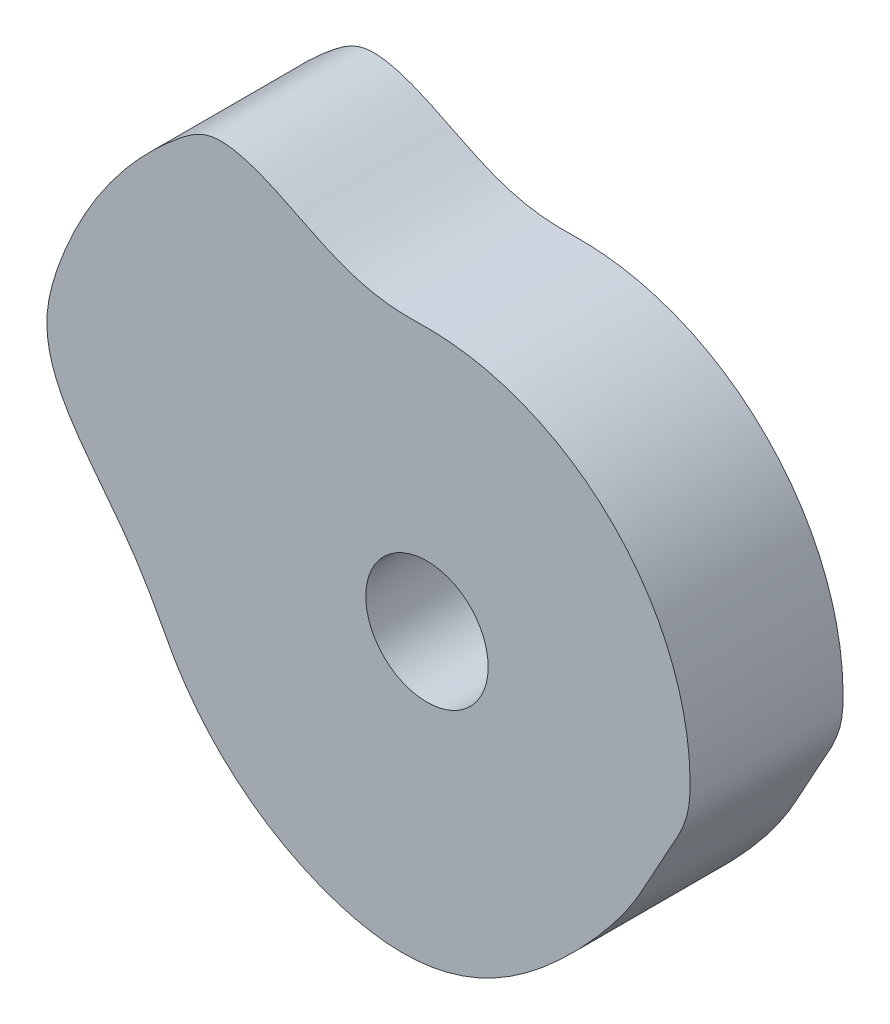
from build123d import *

# Parameters (mm, degrees)
EXTRUDE_1_DEPTH     = 25
SKETCH_2_R          = 10
CUT_EXTRUDE_1_DEPTH = 25


with BuildPart() as part:
    # 草图1 → 凸台-拉伸1 (new body)
    with BuildSketch(Plane.XY):
        with BuildLine():
            add(Edge.make_bspline(
                [(-0.0087, 43), (-0.136801246, 42.999974952), (-0.407441059, 42.998766051), (-0.832136373, 42.99455358), (-1.294130239, 42.989512439), (-1.7901566, 42.984526724), (-2.319432897, 42.982257504), (-2.880930732, 42.984414446), (-3.473264397, 42.993353644), (-4.094707637, 43.011728838), (-4.74309332, 43.042050093), (-5.415836583, 43.086499882), (-6.109912176, 43.147543537), (-6.822049055, 43.226769244), (-7.548570838, 43.326161618), (-8.28582959, 43.446231966), (-9.030064569, 43.587780855), (-9.777675941, 43.750781386), (-10.525462945, 43.934475465), (-11.270486369, 44.138011479), (-12.01037436, 44.360113901), (-12.743207067, 44.599213347), (-13.46755524, 44.853759027), (-14.182631286, 45.121610152), (-14.887824829, 45.401437576), (-15.583162743, 45.69109368), (-16.268800862, 45.989010998), (-16.94511139, 46.293617539), (-17.612622808, 46.60343428), (-18.271898468, 46.916975053), (-18.923664827, 47.232625632), (-19.568330886, 47.549457156), (-20.2065692, 47.865924838), (-20.838840452, 48.180718731), (-21.465282629, 48.492938602), (-22.086405093, 48.800769315), (-22.702083929, 49.103500141), (-23.312324139, 49.399797612), (-23.917108048, 49.688183152), (-24.515839683, 49.968055714), (-25.108437608, 50.237595421), (-25.694057407, 50.496318404), (-26.272226986, 50.742716915), (-26.842057273, 50.976120623), (-27.402841198, 51.195357032), (-27.953591701, 51.399839699), (-28.493345529, 51.588807405), (-29.021099894, 51.761769203), (-29.535911186, 51.918086626), (-30.036801652, 52.057491891), (-30.522749568, 52.180089658), (-30.992938579, 52.285742712), (-31.446589144, 52.374802285), (-31.883198953, 52.447259403), (-32.302264075, 52.503976933), (-32.703607745, 52.545496988), (-33.087293474, 52.572513943), (-33.453682872, 52.585769754), (-33.803402817, 52.586244349), (-34.137382489, 52.574624574), (-34.45690126, 52.551844259), (-34.763531167, 52.518204266), (-35.059054933, 52.474439263), (-35.34554334, 52.420877049), (-35.625065777, 52.357102176), (-35.900022529, 52.283360548), (-36.172712283, 52.199021259), (-36.445350376, 52.10334573), (-36.720146201, 51.995474056), (-36.999152779, 51.874447439), (-37.284087058, 51.738810946), (-37.576740593, 51.587714415), (-37.878406034, 51.419857325), (-38.190230811, 51.234035113), (-38.513264952, 51.029392301), (-38.848273378, 50.80494079), (-39.196038006, 50.560145128), (-39.557098495, 50.294485672), (-39.932008194, 50.007720932), (-40.321399641, 49.699943452), (-40.725634914, 49.371171378), (-41.14220467, 49.024745914), (-41.565260904, 48.666599849), (-41.988308339, 48.30201179), (-42.408253609, 47.933798413), (-42.824965586, 47.561916245), (-43.238321887, 47.186302779), (-43.648428976, 46.807180785), (-44.05531959, 46.424613528), (-44.458620092, 46.038244131), (-44.858789404, 45.648620452), (-45.255347515, 45.255347515), (-45.648620453, 44.858789404), (-46.038244129, 44.45862009), (-46.424613538, 44.055319599), (-46.807180748, 43.648428945), (-47.186302918, 43.238322004), (-47.561915728, 42.824965149), (-47.933800342, 42.40825524), (-48.302004592, 41.988302254), (-48.666643323, 41.565264343), (-49.027394649, 41.138872519), (-49.384642891, 40.709568456), (-49.737932173, 40.276976865), (-50.087524796, 39.841404878), (-50.433351966, 39.402824857), (-50.775207765, 38.961171938), (-51.113388895, 38.516723924), (-51.447432113, 38.069138182), (-51.777777762, 37.618794795), (-52.104055471, 37.165484811), (-52.426351944, 36.709333685), (-52.744801495, 36.250487924), (-53.059018205, 35.788749725), (-53.369430176, 35.324454558), (-53.675538922, 34.857314222), (-53.97783332, 34.387659146), (-54.275744439, 33.915223228), (-54.569731706, 33.440339509), (-54.859337521, 32.962804404), (-55.145066351, 32.48292908), (-55.42626102, 32.00037046), (-55.703527831, 31.515523034), (-55.976387413, 31.02820883), (-56.245044448, 30.538582233), (-56.509296559, 30.046548047), (-56.769430659, 29.55231061), (-57.025104614, 29.055756028), (-57.276547902, 28.557070866), (-57.523524319, 28.056119025), (-57.766230888, 27.553097527), (-58.004438952, 27.047928301), (-58.238249859, 26.540710119), (-58.467638467, 26.031463054), (-58.692516942, 25.520216236), (-58.91308064, 25.007101563), (-59.129026488, 24.49202226), (-59.340564316, 23.975128422), (-59.547476062, 23.456362805), (-59.749812029, 22.935815943), (-59.947799554, 22.413572259), (-60.140463282, 21.891123917), (-60.327099032, 21.371640471), (-60.505807364, 20.857970478), (-60.676219819, 20.35169593), (-60.837449134, 19.852530966), (-60.989805395, 19.360499291), (-61.132854899, 18.875385964), (-61.266200832, 18.396966006), (-61.390184092, 17.925244629), (-61.504262213, 17.459853677), (-61.608698411, 17.000726879), (-61.70322647, 16.547506834), (-61.787833588, 16.099975505), (-61.862513962, 15.657795072), (-61.927417656, 15.220718715), (-61.982523212, 14.788368514), (-62.027800238, 14.360375474), (-62.063290476, 13.936310631), (-62.088922872, 13.515769157), (-62.104882194, 13.098328182), (-62.111108706, 12.683516077), (-62.10765592, 12.270866494), (-62.094353079, 11.859881462), (-62.071229461, 11.450131809), (-62.038344613, 11.041105155), (-61.995398903, 10.632421262), (-61.942427585, 10.223573183), (-61.879424287, 9.81420857), (-61.806029258, 9.403930359), (-61.722246692, 8.992420571), (-61.6279935, 8.579330737), (-61.52298567, 8.164429807), (-61.407176267, 7.747468352), (-61.280542809, 7.328241536), (-61.142669239, 6.906729143), (-60.993899874, 6.482688724), (-60.833944831, 6.056119791), (-60.66256931, 5.627079189), (-60.480237456, 5.19541266), (-60.286612037, 4.761285825), (-60.081932736, 4.324680526), (-59.866285042, 3.885698088), (-59.639672911, 3.4445058), (-59.402404472, 3.001133348), (-59.154637682, 2.55566729), (-58.896615437, 2.108288231), (-58.62858506, 1.659076818), (-58.350996693, 1.208094331), (-58.063998486, 0.75548998), (-57.768238332, 0.301226424), (-57.463584199, -0.154345594), (-57.151019869, -0.611546605), (-56.830678235, -1.070156264), (-56.503012179, -1.530149798), (-56.168603979, -1.991668893), (-55.827748396, -2.454656326), (-55.481077055, -2.919208892), (-55.128949746, -3.38535534), (-54.772101056, -3.853341157), (-54.410725175, -4.323100456), (-54.045635528, -4.79494129), (-53.677071874, -5.268778392), (-53.305837746, -5.745014758), (-52.932375945, -6.223714528), (-52.556938036, -6.704858868), (-52.180667195, -7.188989927), (-51.803420134, -7.675731061), (-51.426378768, -8.165677949), (-51.049653639, -8.658586755), (-50.674096208, -9.154726539), (-50.299966874, -9.653816146), (-49.928208484, -10.156130034), (-49.559171848, -10.661403811), (-49.193236283, -11.169373662), (-48.831482889, -11.680219568), (-48.473815319, -12.193146555), (-48.121149125, -12.708162345), (-47.773932439, -13.224756119), (-47.432277775, -13.742269968), (-47.096842089, -14.260288663), (-46.768150719, -14.778327896), (-46.446054103, -15.295421886), (-46.130943373, -15.810960998), (-45.823101724, -16.324312285), (-45.522465415, -16.834608651), (-45.229067865, -17.341052296), (-44.943073001, -17.842921264), (-44.664047074, -18.339292633), (-44.392154348, -18.829553029), (-44.126936062, -19.312840294), (-43.868453253, -19.788567673), (-43.616000527, -20.255864249), (-43.369760345, -20.714327505), (-43.128743619, -21.163036355), (-42.893406799, -21.601852119), (-42.662643928, -22.029857955), (-42.43670304, -22.446903744), (-42.214925181, -22.852397599), (-41.996974307, -23.246002634), (-41.782835528, -23.627598704), (-41.570777552, -23.99845838), (-41.358722403, -24.36213605), (-41.144521292, -24.722100882), (-40.927218358, -25.080217479), (-40.706805761, -25.436428237), (-40.483323885, -25.790725194), (-40.25671791, -26.14304088), (-40.026996354, -26.493323765), (-39.794321782, -26.841626321), (-39.558581476, -27.187874322), (-39.319837411, -27.532043633), (-39.077946071, -27.874041082), (-38.833321357, -28.214071725), (-38.585589034, -28.551844013), (-38.334988479, -28.887463067), (-38.081450031, -29.220912546), (-37.825020552, -29.552135861), (-37.5656583, -29.881100311), (-37.303464685, -30.207765097), (-37.038504466, -30.532212942), (-36.770538961, -30.854157045), (-36.499981963, -31.173908502), (-36.226526987, -31.491215909), (-35.950375339, -31.806183048), (-35.67147504, -32.118735206), (-35.389720854, -32.428680015), (-35.105455066, -32.736329985), (-34.818431001, -33.041429822), (-34.528760187, -33.344014895), (-34.236412318, -33.644023573), (-33.941541048, -33.941541048), (-33.644023573, -34.236412318), (-33.344014895, -34.528760187), (-33.041429822, -34.818431001), (-32.736329985, -35.105455066), (-32.428680015, -35.389720854), (-32.118735206, -35.67147504), (-31.806183048, -35.950375339), (-31.491215909, -36.226526987), (-31.173908502, -36.499981963), (-30.854157045, -36.770538961), (-30.532212942, -37.038504466), (-30.207765097, -37.303464685), (-29.881100311, -37.5656583), (-29.552135861, -37.825020552), (-29.220912546, -38.081450031), (-28.887463067, -38.334988479), (-28.551844013, -38.585589034), (-28.214071725, -38.833321357), (-27.874041082, -39.077946071), (-27.532043633, -39.319837411), (-27.187874322, -39.558581476), (-26.841626321, -39.794321782), (-26.493323764, -40.026996353), (-26.143040882, -40.256717913), (-25.790725187, -40.483323872), (-25.436428266, -40.706805809), (-25.080217373, -40.927218176), (-24.722101278, -41.144521968), (-24.362134574, -41.358719879), (-24.000271187, -41.569733163), (-23.63665123, -41.777622334), (-23.271145283, -41.982252136), (-22.903895013, -42.183720028), (-22.534910017, -42.382048892), (-22.164164975, -42.577031095), (-21.791802774, -42.76884098), (-21.417737842, -42.957346839), (-21.042074796, -43.142656853), (-20.664773398, -43.324620929), (-20.285971399, -43.503392705), (-19.90552166, -43.678617092), (-19.523661325, -43.85077571), (-19.14024278, -44.01947576), (-18.755328588, -44.184738168), (-18.369040121, -44.346772776), (-17.981348719, -44.505355182), (-17.5922864, -44.660557298), (-17.201938123, -44.812481611), (-16.810223913, -44.960892301), (-16.417433871, -45.10565033), (-16.024160373, -45.246937081), (-15.630815972, -45.384224679), (-15.237653527, -45.517424349), (-14.844803543, -45.646664363), (-14.452187374, -45.771676314), (-14.059820241, -45.892460728), (-13.667789613, -46.009251732), (-13.275958282, -46.121465623), (-12.884508294, -46.22966675), (-12.493368184, -46.333395216), (-12.10262478, -46.433006747), (-11.712215276, -46.527960683), (-11.322197563, -46.618579568), (-10.932589311, -46.704814766), (-10.543397453, -46.786509259), (-10.154643744, -46.863726323), (-9.766365184, -46.936464051), (-9.378527476, -47.004522365), (-8.991228006, -47.068216952), (-8.604379829, -47.127036886), (-8.218076919, -47.181533479), (-7.832271633, -47.23117619), (-7.447023472, -47.276345125), (-7.062321306, -47.316700251), (-6.678234781, -47.352542515), (-6.294740505, -47.383650124), (-5.911846075, -47.410058244), (-5.529550861, -47.431748913), (-5.147925276, -47.448805367), (-4.766958903, -47.460929273), (-4.386633222, -47.468620029), (-4.006969431, -47.471362519), (-3.627972391, -47.469526943), (-3.249712187, -47.462749617), (-2.872145783, -47.451521419), (-2.495313905, -47.435422518), (-2.119225226, -47.414458722), (-1.743852457, -47.389032937), (-1.369260795, -47.358690746), (-0.995429797, -47.323702298), (-0.622399795, -47.283997798), (-0.250169561, -47.239596374), (0.121260737, -47.190494066), (0.491890373, -47.136687599), (0.86168979, -47.078199164), (1.230609998, -47.014971832), (1.598668302, -46.947148989), (1.965882636, -46.874800307), (2.33217999, -46.797613328), (2.697642756, -46.716092928), (3.062135905, -46.629702695), (3.425755714, -46.538964423), (3.78839281, -46.443497946), (4.150095017, -46.34362194), (4.510846061, -46.239182455), (4.870621021, -46.130322488), (5.229381677, -46.016845275), (5.587152895, -45.899076508), (5.943885923, -45.776886441), (6.299508509, -45.650156141), (6.654236171, -45.519525127), (7.007705972, -45.384032689), (7.360241608, -45.244759643), (7.711575735, -45.100946031), (8.06186027, -44.953105887), (8.410979438, -44.800945819), (8.758954886, -44.644744269), (9.105825578, -44.484537171), (9.451469232, -44.320204167), (9.796016178, -44.152018233), (10.139291701, -43.979819461), (10.481321578, -43.803637244), (10.822208421, -43.623795926), (11.161812996, -43.440034356), (11.500232026, -43.252630488), (11.837387174, -43.061563728), (12.173256985, -42.866775481), (12.507861487, -42.668517071), (12.841258729, -42.466821413), (13.173198137, -42.261437777), (13.504002408, -42.052869831), (13.833503547, -41.840993432), (14.161606122, -41.625702201), (14.488509832, -41.407381105), (14.813978084, -41.185678424), (15.138271015, -40.961142465), (15.461186422, -40.733539948), (15.782655803, -40.502850324), (16.102995659, -40.269497999), (16.421932492, -40.033203894), (16.739518746, -39.794157377), (17.055860931, -39.552604925), (17.370708843, -39.308244261), (17.684331848, -39.061458249), (17.996603049, -38.812140489), (18.307618528, -38.560445335), (18.617252181, -38.306358097), (18.925568799, -38.050065036), (19.23248942, -37.791497962), (19.538122973, -37.530853714), (19.842436271, -37.268157623), (20.145310588, -37.003413096), (20.446961525, -36.73682723), (20.747159861, -36.46824107), (21.046115734, -36.197923764), (21.343643806, -35.925839634), (21.639891895, -35.652149764), (21.934627607, -35.376739315), (22.228044201, -35.099849419), (22.520014962, -34.821444689), (22.810620792, -34.541643893), (23.099797725, -34.260480641), (23.387469663, -33.977945067), (23.673777517, -33.694280561), (23.958577258, -33.409373796), (24.241858143, -33.123281963), (24.523622288, -32.836074668), (24.803939201, -32.547949885), (25.082500915, -32.258676342), (25.359585499, -31.968653608), (25.635014601, -31.67771061), (25.908781055, -31.385938491), (26.18089872, -31.093379969), (26.451126307, -30.799944007), (26.719781231, -30.505986253), (26.986531551, -30.211269276), (27.25155403, -29.916043679), (27.514512247, -29.620104504), (27.775656689, -29.323705103), (28.034797436, -29.026772443), (28.2919311, -28.729333694), (28.546975576, -28.431504191), (28.799942195, -28.133259622), (29.050681232, -27.834597061), (29.29929536, -27.535630357), (29.545589852, -27.236319384), (29.789633918, -26.936715121), (30.031236307, -26.636783583), (30.270558134, -26.336672956), (30.507138003, -26.036144914), (30.741510801, -25.735639149), (30.973121419, -25.434779489), (31.202084376, -25.133735197), (31.428384248, -24.83252702), (31.652026931, -24.531241362), (31.872805166, -24.229773561), (32.090712238, -23.928169119), (32.305746781, -23.626450502), (32.517811789, -23.32462892), (32.726842637, -23.022683088), (32.9328184, -22.72071223), (33.135807547, -22.41871572), (33.335410047, -22.116539232), (33.532020432, -21.814399095), (33.725250975, -21.512184098), (33.91522037, -21.209926659), (34.101780874, -20.907622676), (34.285147707, -20.605409208), (34.464810996, -20.303032603), (34.642360771, -19.998699877), (34.819844185, -19.688100258), (34.999934972, -19.367391821), (35.183986734, -19.034902918), (35.372068404, -18.691030588), (35.564282283, -18.336393916), (35.760735291, -17.971646854), (35.961330895, -17.597536793), (36.166124209, -17.215028456), (36.374925997, -16.825022172), (36.587706901, -16.428657771), (36.804183828, -16.026957056), (37.024117752, -15.621122838), (37.246815255, -15.212143814), (37.472299737, -14.801439569), (37.699533968, -14.389830784), (37.928400018, -13.97868762), (38.157736844, -13.568798382), (38.38735425, -13.161433631), (38.616174625, -12.757334378), (38.843438436, -12.357303486), (39.068522835, -11.962222685), (39.290663821, -11.572707674), (39.508950358, -11.189275677), (39.722845223, -10.812504148), (39.931477794, -10.442710191), (40.13439194, -10.080344671), (40.330785044, -9.725523455), (40.520434667, -9.378566676), (40.702781409, -9.039484449), (40.8774104, -8.708320169), (41.044277254, -8.385188241), (41.202699387, -8.069758088), (41.352991618, -7.762111856), (41.495228683, -7.462056495), (41.62885009, -7.169050843), (41.754551057, -6.88294007), (41.872338055, -6.603240684), (41.982103149, -6.329241816), (42.084732063, -6.060636963), (42.180065191, -5.796518857), (42.268631765, -5.536146023), (42.35078827, -5.278686792), (42.426682662, -5.023102052), (42.497043774, -4.768584475), (42.561886452, -4.513904514), (42.621388093, -4.258053711), (42.676247336, -3.999961292), (42.726274406, -3.738466265), (42.771786558, -3.472473764), (42.813045348, -3.200966911), (42.849922285, -2.922911567), (42.882611994, -2.637328763), (42.911145185, -2.343345282), (42.935751408, -2.040143604), (42.956156983, -1.727032776), (42.972599028, -1.403430151), (42.985073303, -1.068829933), (42.993978074, -0.722873766), (42.998897437, -0.36531563), (43.000543095, 0.001999727), (42.998949106, 0.375247641), (42.994049963, 0.750462097), (42.985855649, 1.125643555), (42.97432407, 1.500688924), (42.959653795, 1.875638652), (42.941656273, 2.250453712), (42.920313464, 2.6250964), (42.895902482, 2.999554986), (42.867871595, 3.373751815), (42.837002226, 3.747751612), (42.802521616, 4.121420028), (42.764930612, 4.494767656), (42.724147489, 4.86778751), (42.680061958, 5.24043753), (42.632627564, 5.612676772), (42.582023042, 5.98448984), (42.528263729, 6.355881936), (42.47112675, 6.726752357), (42.410855157, 7.097143788), (42.347208191, 7.46693842), (42.280558333, 7.836240482), (42.210525665, 8.20487618), (42.137361706, 8.572938303), (42.06080247, 8.940293322), (41.98124237, 9.307023193), (41.898423534, 9.673033748), (41.812452854, 10.038288786), (41.723224379, 10.402763636), (41.630805873, 10.766431296), (41.535338688, 11.129363382), (41.436617784, 11.491396576), (41.334857033, 11.852608679), (41.229685717, 12.212806886), (41.121659587, 12.572163751), (41.010292949, 12.930481489), (40.895918028, 13.287870552), (40.778428755, 13.644255969), (40.657803583, 13.999595819), (40.534115244, 14.353881531), (40.407337789, 14.70707199), (40.277385194, 15.059088686), (40.144502754, 15.410022628), (40.008540282, 15.759786702), (39.869387241, 16.108301106), (39.727316418, 16.455594787), (39.582184161, 16.801630029), (39.434091743, 17.146414921), (39.283038903, 17.489933513), (39.128766364, 17.832020158), (38.971684819, 18.172809673), (38.811724425, 18.512276471), (38.64856988, 18.850184512), (38.482696605, 19.186779306), (38.313775484, 19.521834771), (38.142001441, 19.855481736), (37.967177778, 20.187517237), (37.789575782, 20.518083204), (37.609068229, 20.847043452), (37.425782671, 21.174486472), (37.239579445, 21.500249009), (37.050562417, 21.824408427), (36.858675011, 22.146879873), (36.663946174, 22.467658092), (36.466573573, 22.786833153), (36.266260894, 23.104167253), (36.063257372, 23.419781238), (35.857563466, 23.733624567), (35.649035484, 24.045600833), (35.437870217, 24.355808451), (35.223940942, 24.664082226), (35.007429274, 24.970571816), (34.788154519, 25.275093382), (34.566256361, 25.577712471), (34.341712913, 25.878330899), (34.114638577, 26.177034677), (33.88492414, 26.47374171), (33.652619516, 26.768456393), (33.417727765, 27.061120961), (33.180337694, 27.351775487), (32.940298243, 27.640205267), (32.697957757, 27.926698097), (32.452846658, 28.210830196), (32.205566795, 28.493083441), (31.955563873, 28.772948246), (31.703338073, 29.050767611), (31.448584515, 29.326271467), (31.191483412, 29.599589627), (30.931998373, 29.870658161), (30.670192861, 30.139505502), (30.40597543, 30.40597543), (30.139505502, 30.670192861), (29.870658161, 30.931998373), (29.599589627, 31.191483412), (29.326271467, 31.448584515), (29.050767611, 31.703338073), (28.772948246, 31.955563873), (28.493083441, 32.205566795), (28.210830196, 32.452846658), (27.926698097, 32.697957757), (27.640205267, 32.940298243), (27.351775487, 33.180337694), (27.061120961, 33.417727765), (26.768456393, 33.652619516), (26.47374171, 33.88492414), (26.177034677, 34.114638577), (25.878330899, 34.341712913), (25.577712471, 34.566256361), (25.275093382, 34.788154519), (24.970571816, 35.007429274), (24.664082226, 35.223940942), (24.355808451, 35.437870217), (24.045600833, 35.649035484), (23.733624567, 35.857563466), (23.419781238, 36.063257372), (23.104167253, 36.266260894), (22.786833153, 36.466573573), (22.467658092, 36.663946174), (22.146879873, 36.858675011), (21.824408427, 37.050562417), (21.500249009, 37.239579445), (21.174486472, 37.425782671), (20.847043452, 37.609068229), (20.518083204, 37.789575782), (20.187517237, 37.967177778), (19.855481736, 38.142001441), (19.521834771, 38.313775484), (19.186779306, 38.482696605), (18.850184512, 38.64856988), (18.512276471, 38.811724425), (18.172809673, 38.971684819), (17.832020158, 39.128766364), (17.489933513, 39.283038903), (17.146414921, 39.434091743), (16.801630029, 39.582184161), (16.455594787, 39.727316418), (16.108301106, 39.869387241), (15.759786702, 40.008540282), (15.410022628, 40.144502754), (15.059088686, 40.277385194), (14.70707199, 40.407337789), (14.353881531, 40.534115244), (13.999595819, 40.657803583), (13.644255969, 40.778428755), (13.287870552, 40.895918028), (12.930481489, 41.010292949), (12.572163751, 41.121659587), (12.212806886, 41.229685717), (11.852608679, 41.334857033), (11.491396576, 41.436617784), (11.129363382, 41.535338688), (10.766431296, 41.630805873), (10.402763636, 41.723224379), (10.038288786, 41.812452854), (9.673033748, 41.898423534), (9.307023193, 41.98124237), (8.940293322, 42.06080247), (8.572938303, 42.137361706), (8.20487618, 42.210525665), (7.836240482, 42.280558333), (7.46693842, 42.347208191), (7.097143788, 42.410855157), (6.726752357, 42.47112675), (6.355881936, 42.528263729), (5.98448984, 42.582023042), (5.612676772, 42.632627564), (5.24043753, 42.680061958), (4.86778751, 42.724147489), (4.494767656, 42.764930612), (4.121420028, 42.802521616), (3.747751612, 42.837002226), (3.373751815, 42.867871595), (2.999554986, 42.895902481), (2.6250964, 42.920313467), (2.250453712, 42.941656263), (1.875638653, 42.959653835), (1.500688923, 42.974323923), (1.12564356, 42.985856195), (0.750462077, 42.994047922), (0.372347951, 42.998994661), (0.119268048, 43.000025022), (-0.0087, 43)],
                knots=[0, 0, 0, 0, 0.001221626, 0.002580943, 0.004050272, 0.005627665, 0.007311495, 0.009097685, 0.010982311, 0.012960733, 0.015026376, 0.017172016, 0.019389838, 0.021670376, 0.024004491, 0.026382044, 0.028793027, 0.0312282, 0.033678225, 0.036135431, 0.038592634, 0.041044439, 0.043485943, 0.045913878, 0.048325934, 0.05072068, 0.053096955, 0.055454802, 0.057794074, 0.060114748, 0.062416663, 0.064700109, 0.066964887, 0.06921032, 0.071435708, 0.073639783, 0.07582115, 0.077978453, 0.080108967, 0.082210718, 0.084281134, 0.086317236, 0.088316037, 0.090274445, 0.09218935, 0.094057806, 0.095876662, 0.097642673, 0.099353708, 0.101007012, 0.102600466, 0.104132614, 0.105602206, 0.107008662, 0.108352638, 0.109634401, 0.110855814, 0.112020003, 0.113130045, 0.114190195, 0.115206211, 0.116184142, 0.117131181, 0.118054528, 0.118962858, 0.119864645, 0.120768662, 0.121684234, 0.122619452, 0.123583317, 0.124583903, 0.125628298, 0.126723693, 0.127875573, 0.1290895, 0.130370001, 0.131720741, 0.133144853, 0.134644547, 0.136221791, 0.137877984, 0.139613414, 0.141388498, 0.143163934, 0.1449392, 0.146714641, 0.148490157, 0.150265456, 0.152040671, 0.153816142, 0.155591576, 0.157366872, 0.159142169, 0.160917602, 0.162693074, 0.164468288, 0.166243588, 0.168019103, 0.169794544, 0.17156981, 0.173345246, 0.175120573, 0.176896092, 0.17867133, 0.180446825, 0.182222263, 0.183997583, 0.185772862, 0.187548106, 0.189323574, 0.191099026, 0.192874342, 0.194649837, 0.196425286, 0.198200477, 0.199975896, 0.20175132, 0.20352681, 0.205302133, 0.207077528, 0.208852749, 0.210628154, 0.21240365, 0.214179054, 0.215954226, 0.217729582, 0.219505125, 0.221280413, 0.223055726, 0.224831056, 0.22660668, 0.228381884, 0.230157227, 0.231932845, 0.233708164, 0.235483443, 0.237258985, 0.239034338, 0.24080952, 0.242585079, 0.24436026, 0.246135679, 0.247895288, 0.249624226, 0.251322163, 0.252989407, 0.254626506, 0.256234062, 0.25781243, 0.259362658, 0.260885196, 0.262381776, 0.263852712, 0.265300055, 0.266724961, 0.268128977, 0.269513623, 0.270881088, 0.27223296, 0.27357149, 0.274898653, 0.276216417, 0.277527406, 0.278833628, 0.280137421, 0.281440804, 0.282746489, 0.284055876, 0.285371972, 0.286695949, 0.288030192, 0.289376448, 0.290736221, 0.29211125, 0.293502946, 0.294912201, 0.296340201, 0.297788115, 0.299256404, 0.300745743, 0.302256548, 0.303789252, 0.305343962, 0.306920471, 0.308518966, 0.310139304, 0.311781308, 0.313443893, 0.315127622, 0.316831325, 0.318554599, 0.320296815, 0.322057665, 0.323836089, 0.325631523, 0.327443439, 0.329271204, 0.331114221, 0.332971165, 0.334842335, 0.336726551, 0.33862318, 0.340531706, 0.342451274, 0.344381605, 0.346321721, 0.348271259, 0.350228942, 0.352194426, 0.354166956, 0.356145213, 0.358128473, 0.360115271, 0.362104668, 0.3640953, 0.366085526, 0.368074058, 0.370058526, 0.372038007, 0.374009823, 0.375972186, 0.377923227, 0.379860508, 0.381781777, 0.383685209, 0.385568747, 0.387429875, 0.389266761, 0.391077314, 0.392860088, 0.394612935, 0.396334523, 0.398023243, 0.399678011, 0.401297341, 0.402880545, 0.404426566, 0.405934443, 0.40740383, 0.408834101, 0.41022505, 0.411576692, 0.41290808, 0.4142397, 0.41557122, 0.416902738, 0.418234355, 0.419565905, 0.42089749, 0.422229037, 0.423560381, 0.424892068, 0.426223498, 0.427555105, 0.42888666, 0.430218076, 0.431549454, 0.432881342, 0.434212697, 0.435544318, 0.436875858, 0.438207376, 0.43953881, 0.440870223, 0.442201957, 0.443533425, 0.444864944, 0.446196423, 0.447527943, 0.448859606, 0.450191066, 0.451522651, 0.452854237, 0.454185697, 0.45551736, 0.45684888, 0.458180359, 0.459511878, 0.460843346, 0.46217508, 0.463506493, 0.464837927, 0.466169445, 0.467500985, 0.468832606, 0.470163961, 0.471495849, 0.472827227, 0.474158643, 0.475490198, 0.476821805, 0.478153234, 0.479484921, 0.480816266, 0.482147813, 0.483479398, 0.484810948, 0.486142565, 0.487474083, 0.488805602, 0.490137223, 0.491468611, 0.492800302, 0.494131531, 0.495463265, 0.496794894, 0.49812637, 0.499457943, 0.500789285, 0.502120925, 0.503452537, 0.504783935, 0.506115376, 0.507446938, 0.508778458, 0.510110043, 0.511441626, 0.512773185, 0.514104526, 0.515436163, 0.516767669, 0.518099151, 0.519428213, 0.520752732, 0.52207211, 0.523386859, 0.52469659, 0.526001421, 0.527301867, 0.528597475, 0.529888243, 0.531174825, 0.532456429, 0.533733651, 0.5350064, 0.536274816, 0.537538974, 0.538798712, 0.540054492, 0.541306098, 0.542553741, 0.543797479, 0.54503757, 0.546274089, 0.547506932, 0.548736545, 0.549962818, 0.551185578, 0.552405634, 0.55362285, 0.554837087, 0.556048517, 0.55725766, 0.558464688, 0.559669154, 0.560871887, 0.562072426, 0.563271295, 0.56446869, 0.565664449, 0.56685912, 0.568052557, 0.569244951, 0.570436493, 0.571627376, 0.572817792, 0.574007934, 0.575197682, 0.576387173, 0.577576905, 0.578766817, 0.579956966, 0.581147675, 0.582338986, 0.583530849, 0.584723674, 0.585917332, 0.587112308, 0.588308172, 0.589505608, 0.590704183, 0.59190407, 0.593105815, 0.59430902, 0.595513989, 0.59672052, 0.59792924, 0.599139717, 0.600352267, 0.601566616, 0.602783328, 0.604001985, 0.605222862, 0.606445673, 0.607670967, 0.608898308, 0.610127951, 0.611360014, 0.612593908, 0.613830572, 0.61506897, 0.616309814, 0.61755298, 0.618798294, 0.620045591, 0.621295321, 0.622547049, 0.623801032, 0.625056828, 0.626314523, 0.627574342, 0.628836289, 0.630099804, 0.63136502, 0.632631944, 0.633900506, 0.635170765, 0.636442583, 0.637716017, 0.638990473, 0.640266004, 0.641543146, 0.642821051, 0.644099765, 0.645379363, 0.646660096, 0.647941135, 0.649222965, 0.650504961, 0.651787374, 0.653069808, 0.654352294, 0.655634645, 0.656916893, 0.658198618, 0.659479854, 0.660760403, 0.662040292, 0.663319324, 0.664597299, 0.665873799, 0.667149062, 0.668422445, 0.669694421, 0.670964566, 0.672232691, 0.673498569, 0.674762242, 0.676023502, 0.677281949, 0.678537584, 0.679790672, 0.681040341, 0.682287069, 0.683529987, 0.684769814, 0.68600589, 0.687238039, 0.688466296, 0.689690938, 0.690910859, 0.692126841, 0.693338368, 0.694545141, 0.695747649, 0.696945235, 0.69813794, 0.699325875, 0.700508645, 0.701686298, 0.702859146, 0.704026357, 0.705188429, 0.706344976, 0.707496412, 0.708642005, 0.709782619, 0.710917178, 0.712046461, 0.713170269, 0.714288187, 0.715400621, 0.716530281, 0.717699636, 0.718908222, 0.720154407, 0.721437406, 0.722754998, 0.72410523, 0.725485584, 0.726892677, 0.728323989, 0.72977571, 0.731244316, 0.732725981, 0.734216632, 0.735712423, 0.737209693, 0.738704005, 0.740191544, 0.741669131, 0.743132596, 0.744579064, 0.746005344, 0.747408796, 0.748786664, 0.750137026, 0.751457848, 0.752747235, 0.75400448, 0.75522859, 0.756418751, 0.757574751, 0.758696686, 0.759784832, 0.76083991, 0.761863267, 0.762855795, 0.763820007, 0.764757329, 0.765670508, 0.766562013, 0.767434969, 0.768293105, 0.769139061, 0.769977362, 0.770811179, 0.771645097, 0.772482217, 0.773327286, 0.774183877, 0.775055548, 0.775946063, 0.776858599, 0.777796632, 0.778762664, 0.779759447, 0.780788811, 0.78185256, 0.782952475, 0.784089015, 0.785262645, 0.786455346, 0.787648455, 0.788841112, 0.790034044, 0.791226696, 0.792419488, 0.793612511, 0.794805204, 0.795998017, 0.797190969, 0.798383913, 0.799576567, 0.800769336, 0.801962344, 0.803155053, 0.80434783, 0.805540763, 0.806733674, 0.807926293, 0.809119389, 0.810312005, 0.811504968, 0.812697689, 0.813890633, 0.81508345, 0.816276296, 0.817469261, 0.818661819, 0.81985468, 0.821047547, 0.822240588, 0.8234332, 0.824626258, 0.825818978, 0.827011632, 0.828204522, 0.829397432, 0.830590154, 0.831783077, 0.832975993, 0.834168696, 0.835361463, 0.836554496, 0.837747296, 0.838940133, 0.840132801, 0.841325685, 0.84251858, 0.843711418, 0.84490432, 0.846097083, 0.847290072, 0.848482677, 0.849675554, 0.850868367, 0.852061356, 0.853254033, 0.854446918, 0.85563967, 0.856832534, 0.858025168, 0.859218098, 0.860410982, 0.861603742, 0.862796804, 0.863989652, 0.865182375, 0.866375239, 0.86756816, 0.868760964, 0.869953562, 0.87114667, 0.872339492, 0.873532121, 0.8747249, 0.875917666, 0.87711051, 0.878303523, 0.879496349, 0.880689281, 0.881882003, 0.883074776, 0.884267757, 0.885460527, 0.886653442, 0.88784612, 0.889038887, 0.890231833, 0.891424598, 0.892617495, 0.893810392, 0.895003156, 0.896196102, 0.897388869, 0.898581548, 0.899774463, 0.900967233, 0.902160213, 0.903352986, 0.904545709, 0.905738641, 0.906931467, 0.90812448, 0.909317324, 0.910510089, 0.911702869, 0.912895497, 0.91408832, 0.915281428, 0.916474025, 0.91766683, 0.91885975, 0.920052615, 0.921245338, 0.922438186, 0.923631248, 0.924824008, 0.926016891, 0.927209822, 0.928402456, 0.929595319, 0.930788071, 0.931980957, 0.933173634, 0.934366622, 0.935559436, 0.936752313, 0.937944918, 0.939137907, 0.94033067, 0.941523572, 0.94271641, 0.943909305, 0.945102188, 0.946294857, 0.947487693, 0.948680494, 0.949873527, 0.951066294, 0.952258996, 0.953451912, 0.954644836, 0.955837557, 0.957030468, 0.958223357, 0.959416011, 0.960608731, 0.96180179, 0.962994401, 0.964187443, 0.965380309, 0.96657317, 0.967765729, 0.968958694, 0.97015154, 0.971344357, 0.972537301, 0.973730021, 0.974922985, 0.976115601, 0.977308697, 0.978501315, 0.979694226, 0.980887159, 0.982079936, 0.983272646, 0.984465653, 0.985658422, 0.986851076, 0.988044021, 0.989236973, 0.990429786, 0.991622478, 0.992815501, 0.994008293, 0.995200945, 0.996393877, 0.997586534, 0.998779644, 1, 1, 1, 1], degree=3))
        make_face()
    extrude(amount=EXTRUDE_1_DEPTH)

    # 草图2 → 切除-拉伸1 (cut)
    with BuildSketch(Plane.XY):
        Circle(SKETCH_2_R)
    extrude(amount=CUT_EXTRUDE_1_DEPTH, mode=Mode.SUBTRACT)


solid = part.part
